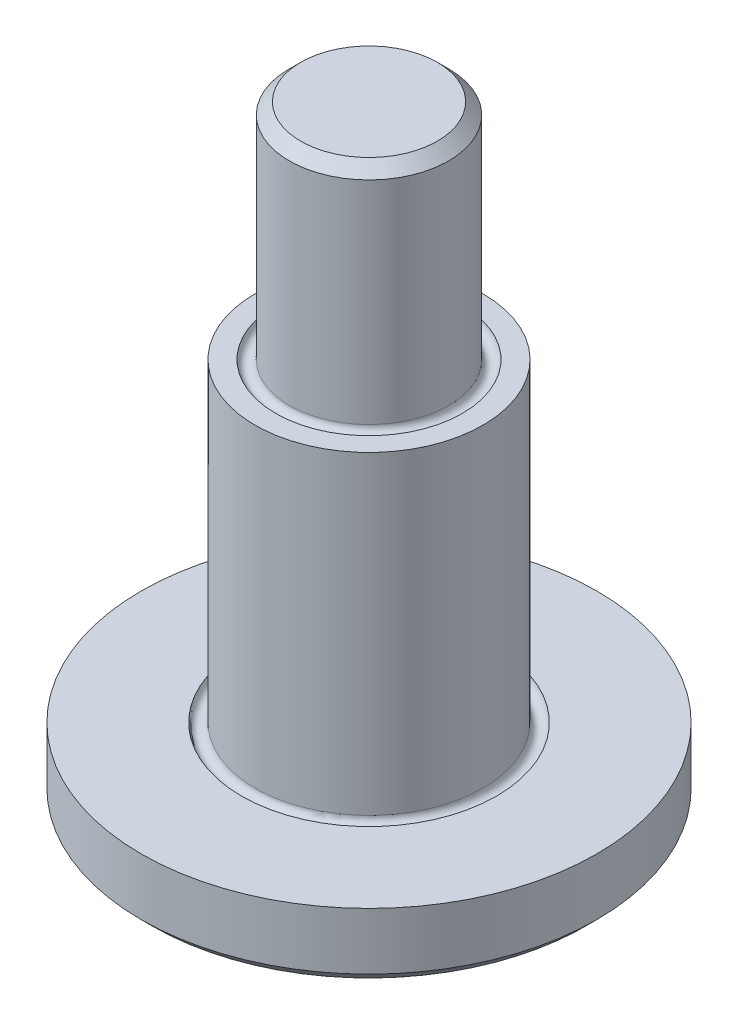
from build123d import *


with BuildPart() as part:
    # Esquisse1 → Base-Révolution (revolve)
    with BuildSketch(Plane(origin=(0, 0, 716.131939029), x_dir=(-1, 0, 0), z_dir=(0, 0, -1)), mode=Mode.PRIVATE) as base_r_volution_sk:
        with BuildLine():
            Line((-2169.949576888, 588.734614361), (-2160.449576888, 588.734614361))
            Line((-2160.449576888, 588.734614361), (-2160.449576888, 615.334513232))
            Line((-2160.449576888, 615.334513232), (-2163.449576888, 615.334513232))
            Line((-2163.449576888, 615.334513232), (-2163.949576888, 614.834513232))
            Line((-2163.949576888, 614.834513232), (-2163.949576888, 605.534359442))
            ThreePointArc((-2163.949576888, 605.534359442), (-2164.249653642, 605.234359452), (-2164.549576849, 605.53451295))
            Line((-2164.549576849, 605.53451295), (-2165.449576888, 605.53451295))
            Line((-2165.449576888, 605.53451295), (-2165.449576888, 591.734359161))
            ThreePointArc((-2165.449576888, 591.734359161), (-2165.749653787, 591.434359171), (-2166.049576849, 591.734512958))
            Line((-2166.049576849, 591.734512958), (-2170.449576888, 591.734512958))
            Line((-2170.449576888, 591.734512958), (-2170.449576888, 589.234614361))
            Line((-2170.449576888, 589.234614361), (-2169.949576888, 588.734614361))
        make_face()
    revolve(base_r_volution_sk.sketch.rotate(Axis((2160.449576888, 588.734614361, 716.131939029), (0, 1, 0)), 90), axis=Axis((2160.449576888, 588.734614361, 716.131939029), (0, 1, 0)))


solid = part.part
